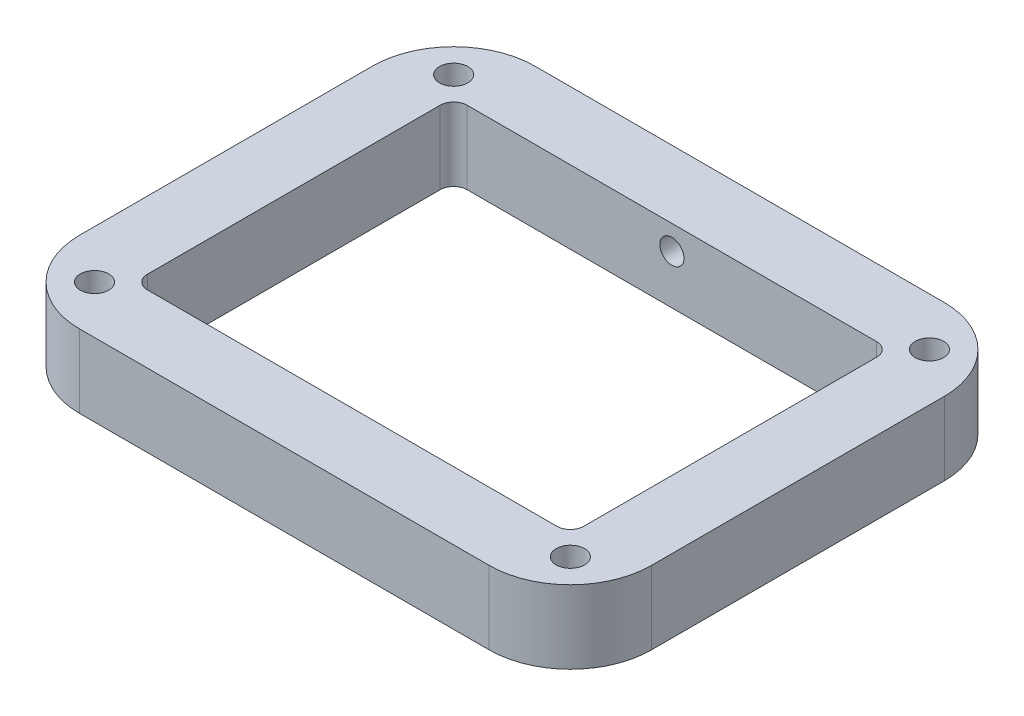
from build123d import *

# Parameters (mm, degrees)
BOSS_EXTRUDE1_DEPTH     = 16
SKETCH2_R               = 2.65
CUT_EXTRUDE1_DEPTH      = 20
CUT_EXTRUDE2_DEPTH      = 111.136478545
CUT_EXTRUDE2_DEPTH_BACK = 111.136478545
CUT_EXTRUDE3_DEPTH      = 111.136478545
CUT_EXTRUDE3_DEPTH_BACK = 111.136478545
SKETCH4_R               = 3.1
CUT_EXTRUDE4_DEPTH      = 111.136478545
CUT_EXTRUDE4_DEPTH_BACK = 6


with BuildPart() as part:
    # Sketch1 → Boss-Extrude1 (new body)
    with BuildSketch(Plane(origin=(0, 0, 0), x_dir=(1, 0, 0), z_dir=(0, 1, 0))):
        with BuildLine():
            Line((-44.75, 10.2375), (44.75, 10.2375))
            ThreePointArc((44.75, 10.2375), (57.301145366, 5.038645366), (62.5, -7.5125))
            Line((62.5, -7.5125), (62.5, -71.5125))
            ThreePointArc((62.5, -71.5125), (57.301145366, -84.063645366), (44.75, -89.2625))
            Line((44.75, -89.2625), (-44.75, -89.2625))
            ThreePointArc((-44.75, -89.2625), (-57.301145366, -84.063645366), (-62.5, -71.5125))
            Line((-62.5, -71.5125), (-62.5, -7.5125))
            ThreePointArc((-62.5, -7.5125), (-57.301145366, 5.038645366), (-44.75, 10.2375))
        make_face()
        with BuildLine():
            Line((-47.5, -7.5125), (-47.5, -71.5125))
            ThreePointArc((-47.5, -71.5125), (-46.694543648, -73.457043648), (-44.75, -74.2625))
            Line((-44.75, -74.2625), (44.75, -74.2625))
            ThreePointArc((44.75, -74.2625), (46.694543648, -73.457043648), (47.5, -71.5125))
            Line((47.5, -71.5125), (47.5, -7.5125))
            ThreePointArc((47.5, -7.5125), (46.694543648, -5.567956352), (44.75, -4.7625))
            Line((44.75, -4.7625), (-44.75, -4.7625))
            ThreePointArc((-44.75, -4.7625), (-46.694543648, -5.567956352), (-47.5, -7.5125))
        make_face(mode=Mode.SUBTRACT)
    extrude(amount=BOSS_EXTRUDE1_DEPTH)

    # Sketch2 → Cut-Extrude1 (cut)
    with BuildSketch(Plane.XY.offset(4.7625)):
        with Locations((0, 10.721875)):
            Circle(SKETCH2_R)
    extrude(amount=-CUT_EXTRUDE1_DEPTH, mode=Mode.SUBTRACT)

    # Sketch3 → Cut-Extrude2 (cut, two sides: drawn at the far end of the back side and taken through both)
    with BuildSketch(Plane(origin=(0, 0, 0), x_dir=(1, 0, 0), z_dir=(0, 1, 0)).offset(-CUT_EXTRUDE2_DEPTH_BACK)):
        with BuildLine():
            Line((-47.7, -7.5125), (-47.7, -71.5125))
            ThreePointArc((-47.7, -71.5125), (-46.835965004, -73.598465004), (-44.75, -74.4625))
            Line((-44.75, -74.4625), (44.75, -74.4625))
            ThreePointArc((44.75, -74.4625), (46.835965004, -73.598465004), (47.7, -71.5125))
            Line((47.7, -71.5125), (47.7, -7.5125))
            ThreePointArc((47.7, -7.5125), (46.835965004, -5.426534996), (44.75, -4.5625))
            Line((44.75, -4.5625), (-44.75, -4.5625))
            ThreePointArc((-44.75, -4.5625), (-46.835965004, -5.426534996), (-47.7, -7.5125))
        make_face()
        with BuildLine():
            Line((-44.75, -74.2625), (44.75, -74.2625))
            ThreePointArc((44.75, -74.2625), (46.694543648, -73.457043648), (47.5, -71.5125))
            Line((47.5, -71.5125), (47.5, -7.5125))
            ThreePointArc((47.5, -7.5125), (46.694543648, -5.567956352), (44.75, -4.7625))
            Line((44.75, -4.7625), (-44.75, -4.7625))
            ThreePointArc((-44.75, -4.7625), (-46.694543648, -5.567956352), (-47.5, -7.5125))
            Line((-47.5, -7.5125), (-47.5, -71.5125))
            ThreePointArc((-47.5, -71.5125), (-46.694543648, -73.457043648), (-44.75, -74.2625))
        make_face(mode=Mode.SUBTRACT)
    extrude(amount=CUT_EXTRUDE2_DEPTH + CUT_EXTRUDE2_DEPTH_BACK, mode=Mode.SUBTRACT)

    # Sketch4 → Cut-Extrude3 (cut, two sides: drawn at the far end of the back side and taken through both)
    with BuildSketch(Plane.XZ.offset(-CUT_EXTRUDE3_DEPTH_BACK)):
        with Locations(Location((-51.997844507, 78.760344507, 0), (0, 0, 270))):
            Circle(SKETCH4_R)
        with Locations(Location((51.997844507, 78.760344507, 0), (0, 0, 270))):
            Circle(SKETCH4_R)
        with Locations(Location((51.997844507, 0.264655493, 0), (0, 0, 270))):
            Circle(SKETCH4_R)
        with Locations(Location((-51.997844507, 0.264655493, 0), (0, 0, 270))):
            Circle(SKETCH4_R)
    extrude(amount=CUT_EXTRUDE3_DEPTH + CUT_EXTRUDE3_DEPTH_BACK, mode=Mode.SUBTRACT)

    # Sketch5 → Cut-Extrude4 (cut, two sides: drawn at the far end of the back side and taken through both)
    with BuildSketch(Plane.XZ.offset(-CUT_EXTRUDE4_DEPTH_BACK)):
        Polygon((-46.108871761, 78.760344507), (-49.053358134, 83.860344507), (-54.94233088, 83.860344507), (-57.886817253, 78.760344507), (-54.94233088, 73.660344507), (-49.053358134, 73.660344507), align=None)
        Polygon((57.886817253, 78.760344507), (54.94233088, 83.860344507), (49.053358134, 83.860344507), (46.108871761, 78.760344507), (49.053358134, 73.660344507), (54.94233088, 73.660344507), align=None)
        Polygon((57.886817253, 0.264655493), (54.94233088, 5.364655493), (49.053358134, 5.364655493), (46.108871761, 0.264655493), (49.053358134, -4.835344507), (54.94233088, -4.835344507), align=None)
        Polygon((-46.108871761, 0.264655493), (-49.053358134, 5.364655493), (-54.94233088, 5.364655493), (-57.886817253, 0.264655493), (-54.94233088, -4.835344507), (-49.053358134, -4.835344507), align=None)
    extrude(amount=CUT_EXTRUDE4_DEPTH + CUT_EXTRUDE4_DEPTH_BACK, mode=Mode.SUBTRACT)


solid = part.part
